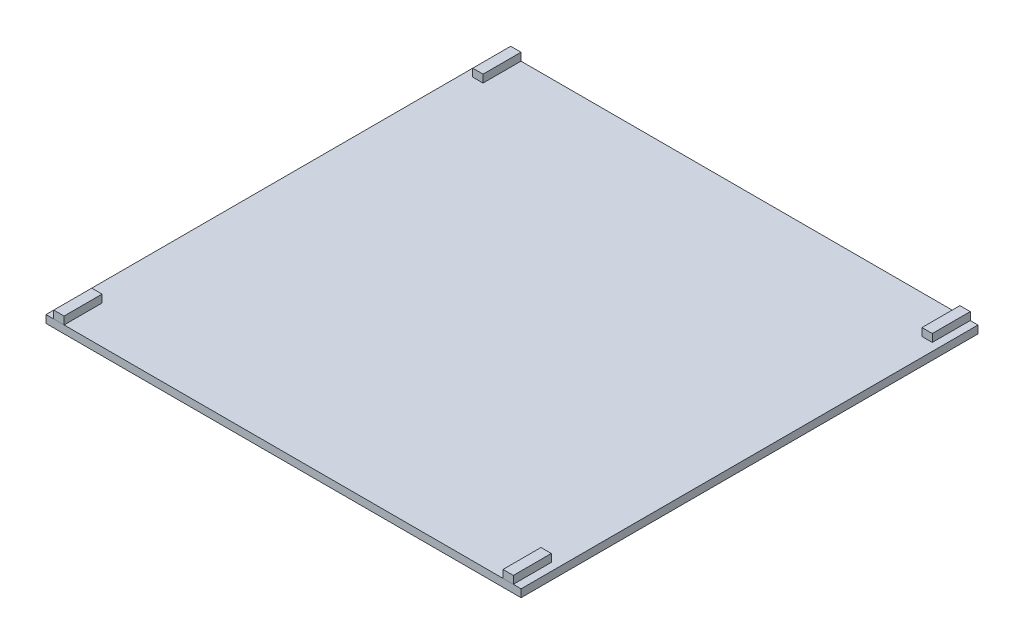
from build123d import *

# Parameters (mm, degrees)
SKETCH_1_W        = 92
SKETCH_1_H        = 88.49
EXTRUDE_1_DEPTH   = 1.5
SKETCH_2_W        = 2
SKETCH_2_H        = 7.35445201
EXTRUDE_2_DEPTH   = 1.5
EXTRUDE_2_2_DEPTH = 1.5
EXTRUDE_2_3_DEPTH = 1.5
EXTRUDE_2_4_DEPTH = 1.5


with BuildPart() as part:
    # Эскиз1 → Бобышка-Вытянуть1 (new body)
    with BuildSketch(Plane(origin=(0, 0, 0), x_dir=(1, 0, 0), z_dir=(0, 1, 0))):
        Rectangle(SKETCH_1_W, SKETCH_1_H)
    extrude(amount=EXTRUDE_1_DEPTH)


with BuildPart() as body_2:
    # Эскиз2 → Бобышка-Вытянуть2 (new body)
    with BuildSketch(Plane(origin=(0, 1.5, 0), x_dir=(1, 0, 0), z_dir=(0, 1, 0))):
        with Locations((43.5, 40.567773995)):
            Rectangle(SKETCH_2_W, SKETCH_2_H)
    extrude(amount=EXTRUDE_2_DEPTH)


with BuildPart() as body_3:
    # Эскиз2 → Extrude 2 2 (new body)
    with BuildSketch(Plane(origin=(0, 1.5, 0), x_dir=(1, 0, 0), z_dir=(0, 1, 0))):
        with Locations((-43.5, 40.567773995)):
            Rectangle(SKETCH_2_W, SKETCH_2_H)
    extrude(amount=EXTRUDE_2_2_DEPTH)


with BuildPart() as body_4:
    # Эскиз2 → Extrude 2 3 (new body)
    with BuildSketch(Plane(origin=(0, 1.5, 0), x_dir=(1, 0, 0), z_dir=(0, 1, 0))):
        with Locations((-43.5, -40.567773995)):
            Rectangle(SKETCH_2_W, SKETCH_2_H)
    extrude(amount=EXTRUDE_2_3_DEPTH)


with BuildPart() as body_5:
    # Эскиз2 → Extrude 2 4 (new body)
    with BuildSketch(Plane(origin=(0, 1.5, 0), x_dir=(1, 0, 0), z_dir=(0, 1, 0))):
        with Locations((43.5, -40.567773995)):
            Rectangle(SKETCH_2_W, SKETCH_2_H)
    extrude(amount=EXTRUDE_2_4_DEPTH)


solid = Compound([part.part, body_2.part, body_3.part, body_4.part, body_5.part])
